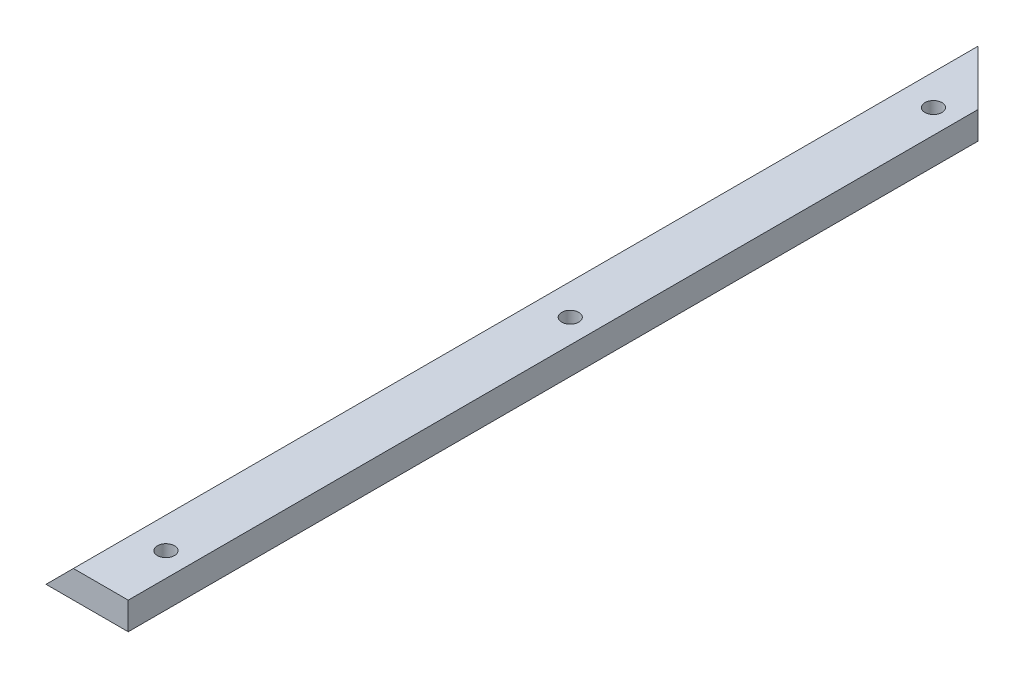
from build123d import *

# Parameters (mm, degrees)
BOSS_EXTRUDE1_DEPTH            = 215.9
CUT_EXTRUDE1_DEPTH             = 218.110576665
F_5_16_0_3125_DIAMETER_HOLE1_D = 7.9375


with BuildPart() as part:
    # Sketch1 → Boss-Extrude1 (new, symmetric)
    with BuildSketch(Plane.XY):
        Polygon((-19.05, -6.35), (-6.35, 6.35), (19.05, 6.35), (19.05, -6.35), align=None)
    extrude(amount=BOSS_EXTRUDE1_DEPTH, both=True)

    # Sketch2 → Cut-Extrude1 (cut, through all)
    with BuildSketch(Plane(origin=(0, 6.35, 0), x_dir=(1, 0, 0), z_dir=(0, 1, 0))):
        Polygon((19.05, 215.9), (-19.05, 215.9), (19.05, 177.8), align=None)
    extrude(amount=-CUT_EXTRUDE1_DEPTH, mode=Mode.SUBTRACT)

    # 5/16 (0.3125) Diameter Hole1 (through all)
    with Locations(Plane(origin=(0, 6.35, 0), x_dir=(1, 0, 0), z_dir=(0, 1, 0))):
        with Locations((7.9375, 168.275), (7.9375, 0), (7.9375, -187.325)):
            Hole(F_5_16_0_3125_DIAMETER_HOLE1_D / 2)


solid = part.part
